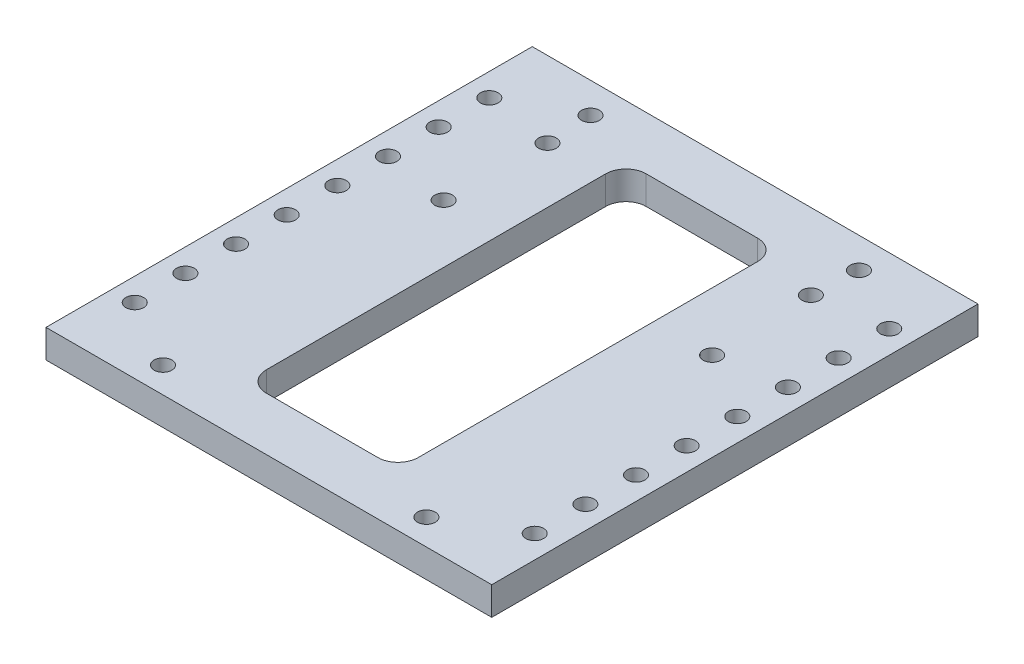
from build123d import *

# Parameters (mm, degrees)
SKETCH1_W           = 88
SKETCH1_H           = 96
BOSS_EXTRUDE1_DEPTH = 5.588
SKETCH3_R           = 1.75
CUT_EXTRUDE1_DEPTH  = 69.733665789
CUT_EXTRUDE2_DEPTH  = 69.733665789
SKETCH5_R           = 1.75
CUT_EXTRUDE3_DEPTH  = 69.733665789


with BuildPart() as part:
    # Sketch1 → Boss-Extrude1 (new body)
    with BuildSketch(Plane(origin=(0, 0, 0), x_dir=(1, 0, 0), z_dir=(0, 1, 0))):
        with Locations((1.952207024, -2.808323514)):
            Rectangle(SKETCH1_W, SKETCH1_H)
    extrude(amount=BOSS_EXTRUDE1_DEPTH)

    # Sketch3 → Cut-Extrude1 (cut, through all)
    with BuildSketch(Plane(origin=(0, 5.588, 0), x_dir=(1, 0, 0), z_dir=(0, 1, 0))):
        with Locations(Location((-24.047792976, 30.191676486, 0), (0, 0, 270))):
            Circle(SKETCH3_R)
        with Locations(Location((27.952207024, 30.191676486, 0), (0, 0, 270))):
            Circle(SKETCH3_R)
        with Locations(Location((-24.047792976, -45.708323514, 0), (0, 0, 270))):
            Circle(SKETCH3_R)
        with Locations(Location((27.952207024, -45.708323514, 0), (0, 0, 270))):
            Circle(SKETCH3_R)
        with Locations(Location((-24.547792976, 39.191676486, 0), (0, 0, 270))):
            Circle(SKETCH3_R)
        with Locations(Location((28.452207024, 39.191676486, 0), (0, 0, 270))):
            Circle(SKETCH3_R)
        with Locations(Location((-24.547792976, 10.191676486, 0), (0, 0, 270))):
            Circle(SKETCH3_R)
        with Locations(Location((28.452207024, 10.191676486, 0), (0, 0, 270))):
            Circle(SKETCH3_R)
    extrude(amount=-CUT_EXTRUDE1_DEPTH, mode=Mode.SUBTRACT)

    # Sketch4 → Cut-Extrude2 (cut, through all)
    with BuildSketch(Plane(origin=(0, 5.588, 0), x_dir=(1, 0, 0), z_dir=(0, 1, 0))):
        with BuildLine():
            Line((-9.047792976, 34.691676486), (12.952207024, 34.691676486))
            ThreePointArc((12.952207024, 34.691676486), (15.780634149, 33.52010361), (16.952207024, 30.691676486))
            Line((16.952207024, 30.691676486), (16.952207024, -36.308323514))
            ThreePointArc((16.952207024, -36.308323514), (15.780634149, -39.136750639), (12.952207024, -40.308323514))
            Line((12.952207024, -40.308323514), (-9.047792976, -40.308323514))
            ThreePointArc((-9.047792976, -40.308323514), (-11.8762201, -39.136750639), (-13.047792976, -36.308323514))
            Line((-13.047792976, -36.308323514), (-13.047792976, 30.691676486))
            ThreePointArc((-13.047792976, 30.691676486), (-11.8762201, 33.52010361), (-9.047792976, 34.691676486))
        make_face()
    extrude(amount=-CUT_EXTRUDE2_DEPTH, mode=Mode.SUBTRACT)

    # Sketch5 → Cut-Extrude3 (cut, through all)
    with BuildSketch(Plane(origin=(0, 5.588, 0), x_dir=(1, 0, 0), z_dir=(0, 1, 0))):
        with Locations(Location((-37.527792976, 32.191676486, 0), (0, 0, 270))):
            Circle(SKETCH5_R)
        with Locations(Location((41.432207024, 32.191676486, 0), (0, 0, 270))):
            Circle(SKETCH5_R)
        with Locations(Location((-37.527792976, 22.191676486, 0), (0, 0, 270))):
            Circle(SKETCH5_R)
        with Locations(Location((41.432207024, 22.191676486, 0), (0, 0, 270))):
            Circle(SKETCH5_R)
        with Locations(Location((-37.527792976, 12.191676486, 0), (0, 0, 270))):
            Circle(SKETCH5_R)
        with Locations(Location((41.432207024, 12.191676486, 0), (0, 0, 270))):
            Circle(SKETCH5_R)
        with Locations(Location((-37.527792976, 2.191676486, 0), (0, 0, 270))):
            Circle(SKETCH5_R)
        with Locations(Location((41.432207024, 2.191676486, 0), (0, 0, 270))):
            Circle(SKETCH5_R)
        with Locations(Location((-37.527792976, -7.808323514, 0), (0, 0, 270))):
            Circle(SKETCH5_R)
        with Locations(Location((41.432207024, -7.808323514, 0), (0, 0, 270))):
            Circle(SKETCH5_R)
        with Locations(Location((-37.527792976, -17.808323514, 0), (0, 0, 270))):
            Circle(SKETCH5_R)
        with Locations(Location((41.432207024, -17.808323514, 0), (0, 0, 270))):
            Circle(SKETCH5_R)
        with Locations(Location((-37.527792976, -27.808323514, 0), (0, 0, 270))):
            Circle(SKETCH5_R)
        with Locations(Location((41.432207024, -27.808323514, 0), (0, 0, 270))):
            Circle(SKETCH5_R)
        with Locations(Location((-37.527792976, -37.808323514, 0), (0, 0, 270))):
            Circle(SKETCH5_R)
        with Locations(Location((41.432207024, -37.808323514, 0), (0, 0, 270))):
            Circle(SKETCH5_R)
    extrude(amount=-CUT_EXTRUDE3_DEPTH, mode=Mode.SUBTRACT)


solid = part.part
